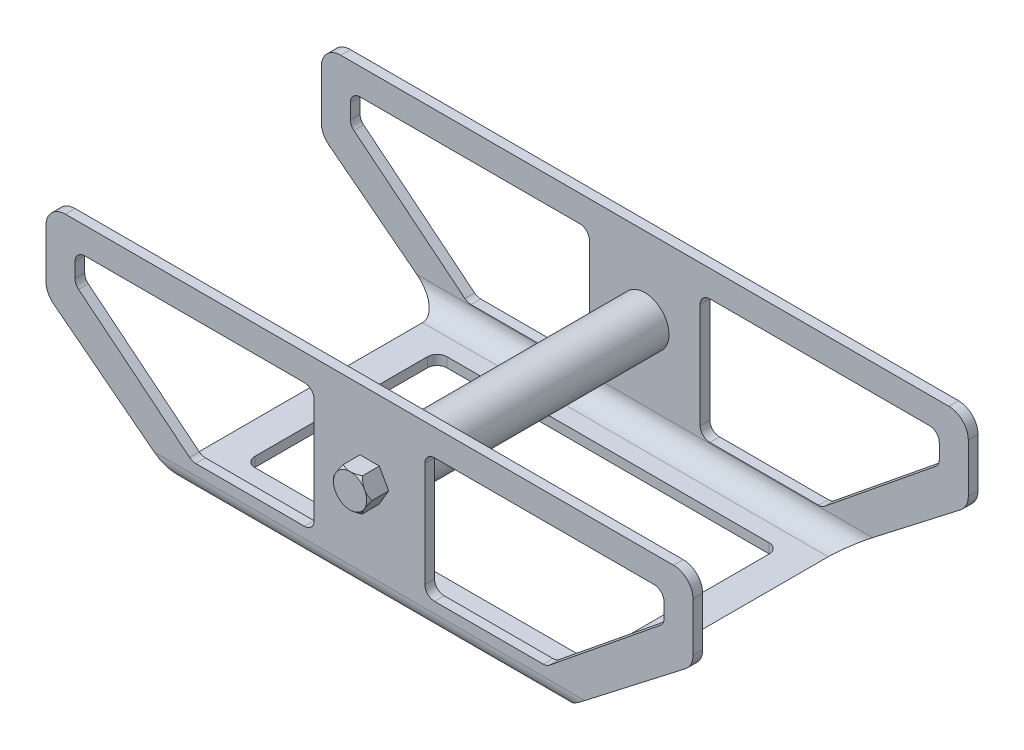
from build123d import *

# Parameters (mm, degrees)
BOSS_EXTRUDE1_DEPTH = 146.875
SKETCH2_W           = 273.75
SKETCH2_H           = 192.54709784
CUT_EXTRUDE1_DEPTH  = 708.854574743
FILLET1_R           = 20
FILLET2_R           = 20
SKETCH3_R           = 25
BOSS_EXTRUDE2_DEPTH = 283.75
BOSS_EXTRUDE3_DEPTH = 20
SKETCH5_R           = 27.786582849
SKETCH5_R_2         = 17.148117484
CUT_EXTRUDE3_DEPTH  = 20
CUT_EXTRUDE3_TAPER  = 45
CUT_EXTRUDE4_DEPTH  = 495.366464437
SKETCH8_W           = 352.22
SKETCH8_H           = 198
CUT_EXTRUDE5_DEPTH  = 20
FILLET3_R           = 20
FILLET4_R           = 10


with BuildPart() as part:
    # Sketch1 → Boss-Extrude1 (new, symmetric)
    with BuildSketch(Plane.XY):
        Polygon((-333.43, 0), (333.43, 0), (333.43, -80.23), (196.11, -186.50354892), (-196.11, -186.50354892), (-333.43, -80.23), align=None)
    extrude(amount=BOSS_EXTRUDE1_DEPTH, both=True)

    # Sketch2 → Cut-Extrude1 (cut, through all)
    with BuildSketch(Plane(origin=(333.43, 0, 0), x_dir=(0, 0, -1), z_dir=(1, 0, 0))):
        with Locations((0, -80.23)):
            Rectangle(SKETCH2_W, SKETCH2_H)
    extrude(amount=-CUT_EXTRUDE1_DEPTH, mode=Mode.SUBTRACT)

    # Fillet1
    fillet1_edges = [part.edges().sort_by_distance(p)[0] for p in [
        (0, -186.50354892, 146.875),
        (0, -186.50354892, -146.875),
    ]]
    fillet(fillet1_edges, radius=FILLET1_R)

    # Fillet2
    fillet2_edges = [part.edges().sort_by_distance(p)[0] for p in [
        (0, -176.50354892, -136.875),
        (0, -176.50354892, 136.875),
    ]]
    fillet(fillet2_edges, radius=FILLET2_R)

    # Sketch3 → Boss-Extrude2 (add)
    with BuildSketch(Plane.XY.offset(146.875)):
        with Locations((0, -80.23)):
            Circle(SKETCH3_R)
    extrude(amount=-BOSS_EXTRUDE2_DEPTH)

    # Sketch6 → Cut-Extrude4 (cut, through all)
    with BuildSketch(Plane(origin=(0, 0, -146.875), x_dir=(-1, 0, 0), z_dir=(0, 0, -1))):
        with BuildLine():
            Line((-303.5, -52.66), (-303.5, -37.26))
            ThreePointArc((-303.5, -37.26), (-300.571067812, -30.188932188), (-293.5, -27.26))
            Line((-293.5, -27.26), (-67, -27.26))
            ThreePointArc((-67, -27.26), (-59.928932188, -30.188932188), (-57, -37.26))
            Line((-57, -37.26), (-57, -145.43))
            ThreePointArc((-57, -145.43), (-59.928932188, -152.501067812), (-67, -155.43))
            Line((-67, -155.43), (-179.12, -155.43))
            ThreePointArc((-179.12, -155.43), (-182.461721995, -154.855120376), (-185.419226414, -153.196578821))
            Line((-185.419226414, -153.196578821), (-299.799226414, -60.426578821))
            ThreePointArc((-299.799226414, -60.426578821), (-302.527520815, -56.961612248), (-303.5, -52.66))
        make_face()
        with BuildLine():
            Line((67, -155.43), (179.12, -155.43))
            ThreePointArc((179.12, -155.43), (182.461721995, -154.855120376), (185.419226414, -153.196578821))
            Line((185.419226414, -153.196578821), (299.799226414, -60.426578821))
            ThreePointArc((299.799226414, -60.426578821), (302.527520815, -56.961612248), (303.5, -52.66))
            Line((303.5, -52.66), (303.5, -37.26))
            ThreePointArc((303.5, -37.26), (300.571067812, -30.188932188), (293.5, -27.26))
            Line((293.5, -27.26), (67, -27.26))
            ThreePointArc((67, -27.26), (59.928932188, -30.188932188), (57, -37.26))
            Line((57, -37.26), (57, -145.43))
            ThreePointArc((57, -145.43), (59.928932188, -152.501067812), (67, -155.43))
        make_face()
    extrude(amount=-CUT_EXTRUDE4_DEPTH, mode=Mode.SUBTRACT)

    # Sketch8 → Cut-Extrude5 (cut)
    with BuildSketch(Plane.XZ.offset(186.50354892)):
        Rectangle(SKETCH8_W, SKETCH8_H)
    extrude(amount=-CUT_EXTRUDE5_DEPTH, mode=Mode.SUBTRACT)

    # Fillet3
    fillet3_edges = [part.edges().sort_by_distance(p)[0] for p in [
        (333.43, -80.23, 141.875),
        (-333.43, -80.23, 141.875),
        (-333.43, 0, 141.875),
        (333.43, 0, 141.875),
        (333.43, -80.23, -141.875),
        (-333.43, -80.23, -141.875),
        (-333.43, 0, -141.875),
        (333.43, 0, -141.875),
    ]]
    fillet(fillet3_edges, radius=FILLET3_R)

    # Fillet4
    fillet4_edges = [part.edges().sort_by_distance(p)[0] for p in [
        (176.11, -181.50354892, 99),
        (176.11, -181.50354892, -99),
        (-176.11, -181.50354892, -99),
        (-176.11, -181.50354892, 99),
    ]]
    fillet(fillet4_edges, radius=FILLET4_R)


with BuildPart() as body_2:
    # Sketch4 → Boss-Extrude3 (new body)
    with BuildSketch(Plane(origin=(0, 0, -146.875), x_dir=(-1, 0, 0), z_dir=(0, 0, -1))):
        Polygon((9.732867587, -62.986203061), (-10.067132413, -63.179190949), (-19.8, -80.422987887), (-9.732867587, -97.473796939), (10.067132413, -97.280809051), (19.8, -80.037012113), align=None)
    extrude(amount=BOSS_EXTRUDE3_DEPTH)

    # Sketch5 → Cut-Extrude3 (cut)
    with BuildSketch(Plane(origin=(0, 0, -166.875), x_dir=(-1, 0, 0), z_dir=(0, 0, -1))):
        with Locations((0, -80.23)):
            Circle(SKETCH5_R)
        with Locations((0, -80.23)):
            Circle(SKETCH5_R_2, mode=Mode.SUBTRACT)
    extrude(amount=-CUT_EXTRUDE3_DEPTH, taper=CUT_EXTRUDE3_TAPER, mode=Mode.SUBTRACT)


with BuildPart() as body_3:
    # Mirror1: mirrored copy
    add(body_2.part.mirror(Plane.XY))


solid = Compound([part.part, body_2.part, body_3.part])
